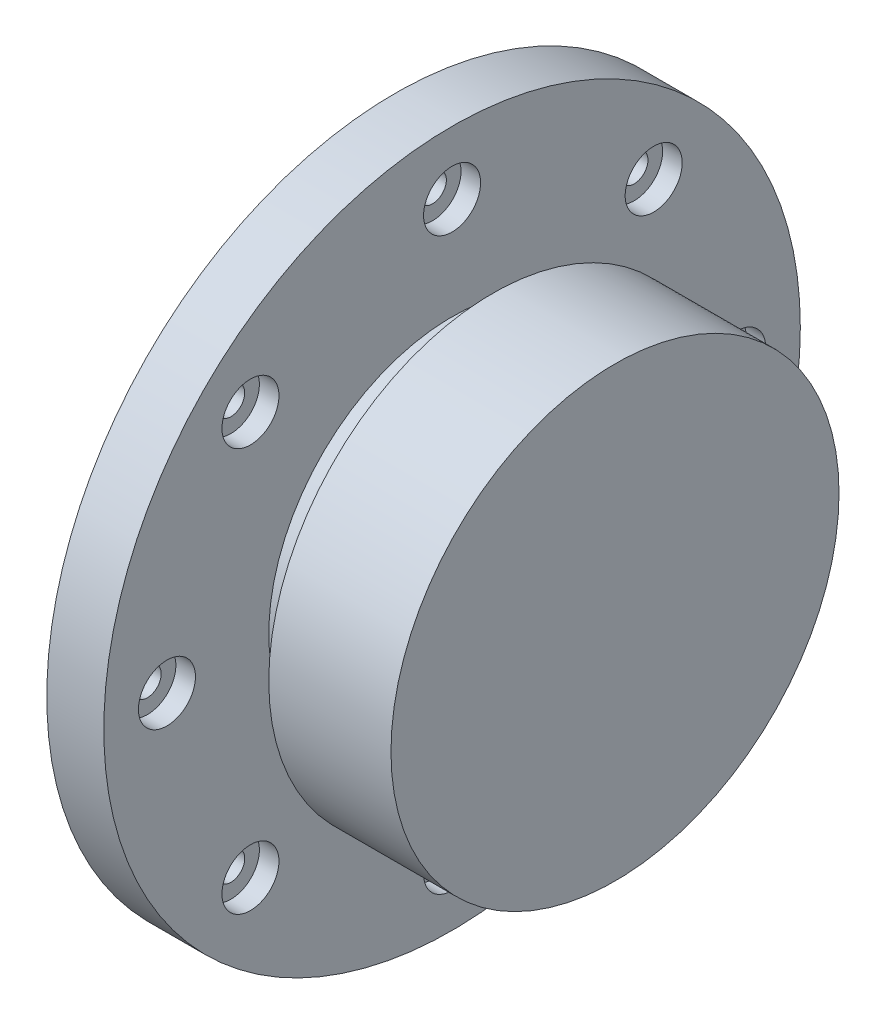
from build123d import *

# Parameters (mm, degrees)
CROQUIS1_R                                           = 42.75
SALIENTE_EXTRUIR1_DEPTH                              = 3.5
REFRENTADO_PARA_TORNILLO_CON_CABEZA_TRON_D           = 3.4
REFRENTADO_PARA_TORNILLO_CON_CABEZA_TRON_DEPTH       = 20
REFRENTADO_PARA_TORNILLO_CON_CABEZA_TRON_CBORE_D     = 7
REFRENTADO_PARA_TORNILLO_CON_CABEZA_TRON_CBORE_DEPTH = 2.4
REFRENTADO_PARA_TORNILLO_CON_CABEZA_TRON_TIP         = 1.021463052
CROQUIS4_R                                           = 22.5
SALIENTE_EXTRUIR2_DEPTH                              = 5
CROQUIS5_R                                           = 27.5
SALIENTE_EXTRUIR3_DEPTH                              = 15


with BuildPart() as part:
    # Croquis1 → Saliente-Extruir1 (new, symmetric)
    with BuildSketch(Plane(origin=(0, 0, 0), x_dir=(0, 0, -1), z_dir=(1, 0, 0))):
        Circle(CROQUIS1_R)
    extrude(amount=SALIENTE_EXTRUIR1_DEPTH, both=True)

    # Refrentado para tornillo con cabeza troncocónica de M31
    with Locations(Plane(origin=(3.5, 0, 0), x_dir=(0, 0, -1), z_dir=(1, 0, 0))):
        with Locations((0, 35), (24.748737342, 24.748737342), (35, 0), (24.748737342, -24.748737342), (0, -35), (-24.748737342, -24.748737342), (-35, 0), (-24.748737342, 24.748737342)):
            CounterBoreHole(REFRENTADO_PARA_TORNILLO_CON_CABEZA_TRON_D / 2, REFRENTADO_PARA_TORNILLO_CON_CABEZA_TRON_CBORE_D / 2, REFRENTADO_PARA_TORNILLO_CON_CABEZA_TRON_CBORE_DEPTH, depth=REFRENTADO_PARA_TORNILLO_CON_CABEZA_TRON_DEPTH)
            with Locations((0, 0, -(REFRENTADO_PARA_TORNILLO_CON_CABEZA_TRON_DEPTH + REFRENTADO_PARA_TORNILLO_CON_CABEZA_TRON_TIP / 2))):  # 118° drill point
                Cone(0, REFRENTADO_PARA_TORNILLO_CON_CABEZA_TRON_D / 2, REFRENTADO_PARA_TORNILLO_CON_CABEZA_TRON_TIP, mode=Mode.SUBTRACT)

    # Croquis4 → Saliente-Extruir2 (add)
    with BuildSketch(Plane(origin=(3.5, 0, 0), x_dir=(0, 0, -1), z_dir=(1, 0, 0))):
        Circle(CROQUIS4_R)
    extrude(amount=SALIENTE_EXTRUIR2_DEPTH)

    # Croquis5 → Saliente-Extruir3 (add)
    with BuildSketch(Plane(origin=(8.5, 0, 0), x_dir=(0, 0, -1), z_dir=(1, 0, 0))):
        Circle(CROQUIS5_R)
    extrude(amount=SALIENTE_EXTRUIR3_DEPTH)


solid = part.part
